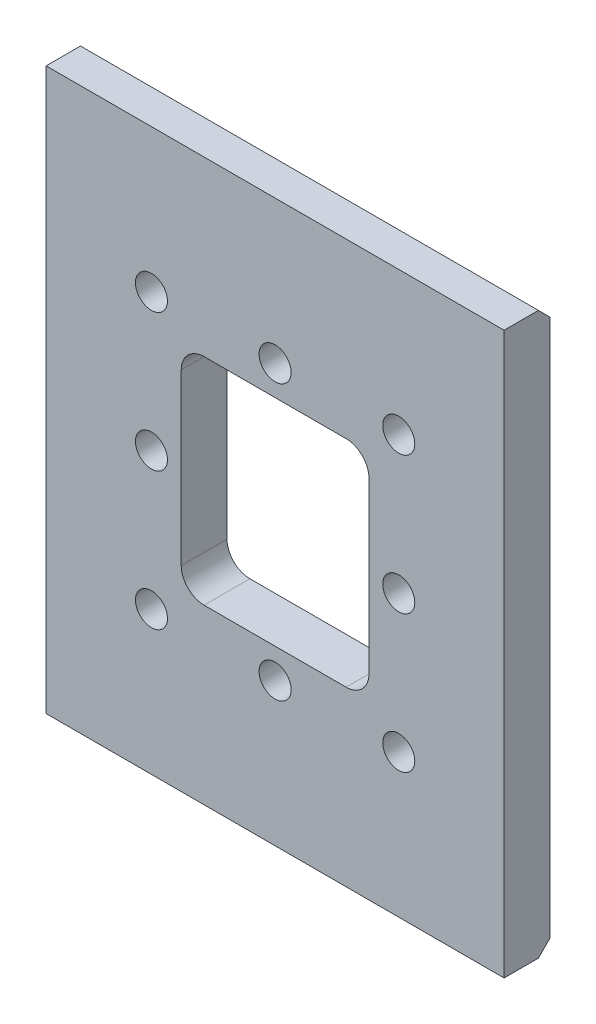
from build123d import *

# Parameters (mm, degrees)
SKETCH_1_W          = 200
SKETCH_1_H          = 245
EXTRUDE_1_DEPTH     = 20
CUT_EXTRUDE_1_REACH = 161.393
SKETCH_2_R          = 7
CHAMFER_1_SIZE      = 5


with BuildPart() as part:
    # 草图1 → 凸台-拉伸1 (new body)
    with BuildSketch(Plane.XY):
        Rectangle(SKETCH_1_W, SKETCH_1_H)
    extrude(amount=EXTRUDE_1_DEPTH)

    # 草图2 → 切除-拉伸1 (cut, up to next)
    with BuildSketch(Plane.XY.offset(20), mode=Mode.PRIVATE) as cut_extrude_1_sk1:
        with Locations((-54, 60)):
            Circle(SKETCH_2_R)
    cut_extrude_1_tool1 = extrude(cut_extrude_1_sk1.sketch, amount=-CUT_EXTRUDE_1_REACH, mode=Mode.PRIVATE) & part.part
    # 草图2 → 切除-拉伸1 (cut, up to next)
    with BuildSketch(Plane.XY.offset(20), mode=Mode.PRIVATE) as cut_extrude_1_sk2:
        with Locations((0, 60)):
            Circle(SKETCH_2_R)
    cut_extrude_1_tool2 = extrude(cut_extrude_1_sk2.sketch, amount=-CUT_EXTRUDE_1_REACH, mode=Mode.PRIVATE) & part.part
    # 草图2 → 切除-拉伸1 (cut, up to next)
    with BuildSketch(Plane.XY.offset(20), mode=Mode.PRIVATE) as cut_extrude_1_sk3:
        with Locations((54, 60)):
            Circle(SKETCH_2_R)
    cut_extrude_1_tool3 = extrude(cut_extrude_1_sk3.sketch, amount=-CUT_EXTRUDE_1_REACH, mode=Mode.PRIVATE) & part.part
    # 草图2 → 切除-拉伸1 (cut, up to next)
    with BuildSketch(Plane.XY.offset(20), mode=Mode.PRIVATE) as cut_extrude_1_sk4:
        with Locations((-54, 0)):
            Circle(SKETCH_2_R)
    cut_extrude_1_tool4 = extrude(cut_extrude_1_sk4.sketch, amount=-CUT_EXTRUDE_1_REACH, mode=Mode.PRIVATE) & part.part
    # 草图2 → 切除-拉伸1 (cut, up to next)
    with BuildSketch(Plane.XY.offset(20), mode=Mode.PRIVATE) as cut_extrude_1_sk5:
        with Locations((54, 0)):
            Circle(SKETCH_2_R)
    cut_extrude_1_tool5 = extrude(cut_extrude_1_sk5.sketch, amount=-CUT_EXTRUDE_1_REACH, mode=Mode.PRIVATE) & part.part
    # 草图2 → 切除-拉伸1 (cut, up to next)
    with BuildSketch(Plane.XY.offset(20), mode=Mode.PRIVATE) as cut_extrude_1_sk6:
        with Locations((-54, -60)):
            Circle(SKETCH_2_R)
    cut_extrude_1_tool6 = extrude(cut_extrude_1_sk6.sketch, amount=-CUT_EXTRUDE_1_REACH, mode=Mode.PRIVATE) & part.part
    # 草图2 → 切除-拉伸1 (cut, up to next)
    with BuildSketch(Plane.XY.offset(20), mode=Mode.PRIVATE) as cut_extrude_1_sk7:
        with Locations((0, -60)):
            Circle(SKETCH_2_R)
    cut_extrude_1_tool7 = extrude(cut_extrude_1_sk7.sketch, amount=-CUT_EXTRUDE_1_REACH, mode=Mode.PRIVATE) & part.part
    # 草图2 → 切除-拉伸1 (cut, up to next)
    with BuildSketch(Plane.XY.offset(20), mode=Mode.PRIVATE) as cut_extrude_1_sk8:
        with Locations((54, -60)):
            Circle(SKETCH_2_R)
    cut_extrude_1_tool8 = extrude(cut_extrude_1_sk8.sketch, amount=-CUT_EXTRUDE_1_REACH, mode=Mode.PRIVATE) & part.part
    # 草图2 → 切除-拉伸1 (cut, up to next)
    with BuildSketch(Plane.XY.offset(20), mode=Mode.PRIVATE) as cut_extrude_1_sk9:
        with BuildLine():
            Line((-31, 47), (31, 47))
            ThreePointArc((31, 47), (38.071067812, 44.071067812), (41, 37))
            Line((41, 37), (41, -37))
            ThreePointArc((41, -37), (38.071067812, -44.071067812), (31, -47))
            Line((31, -47), (-31, -47))
            ThreePointArc((-31, -47), (-38.071067812, -44.071067812), (-41, -37))
            Line((-41, -37), (-41, 37))
            ThreePointArc((-41, 37), (-38.071067812, 44.071067812), (-31, 47))
        make_face()
    cut_extrude_1_tool9 = extrude(cut_extrude_1_sk9.sketch, amount=-CUT_EXTRUDE_1_REACH, mode=Mode.PRIVATE) & part.part
    add(cut_extrude_1_tool1.solids().sort_by_distance((-54, 60, 20))[0], mode=Mode.SUBTRACT)
    add(cut_extrude_1_tool2.solids().sort_by_distance((0, 60, 20))[0], mode=Mode.SUBTRACT)
    add(cut_extrude_1_tool3.solids().sort_by_distance((54, 60, 20))[0], mode=Mode.SUBTRACT)
    add(cut_extrude_1_tool4.solids().sort_by_distance((-54, 0, 20))[0], mode=Mode.SUBTRACT)
    add(cut_extrude_1_tool5.solids().sort_by_distance((54, 0, 20))[0], mode=Mode.SUBTRACT)
    add(cut_extrude_1_tool6.solids().sort_by_distance((-54, -60, 20))[0], mode=Mode.SUBTRACT)
    add(cut_extrude_1_tool7.solids().sort_by_distance((0, -60, 20))[0], mode=Mode.SUBTRACT)
    add(cut_extrude_1_tool8.solids().sort_by_distance((54, -60, 20))[0], mode=Mode.SUBTRACT)
    add(cut_extrude_1_tool9.solids().sort_by_distance((0, 0, 20))[0], mode=Mode.SUBTRACT)

    # 倒角1
    chamfer_1_edges = [part.edges().sort_by_distance(p)[0] for p in [
        (0, -122.5, 0),
        (0, 122.5, 0),
    ]]
    chamfer(chamfer_1_edges, length=CHAMFER_1_SIZE)


solid = part.part
